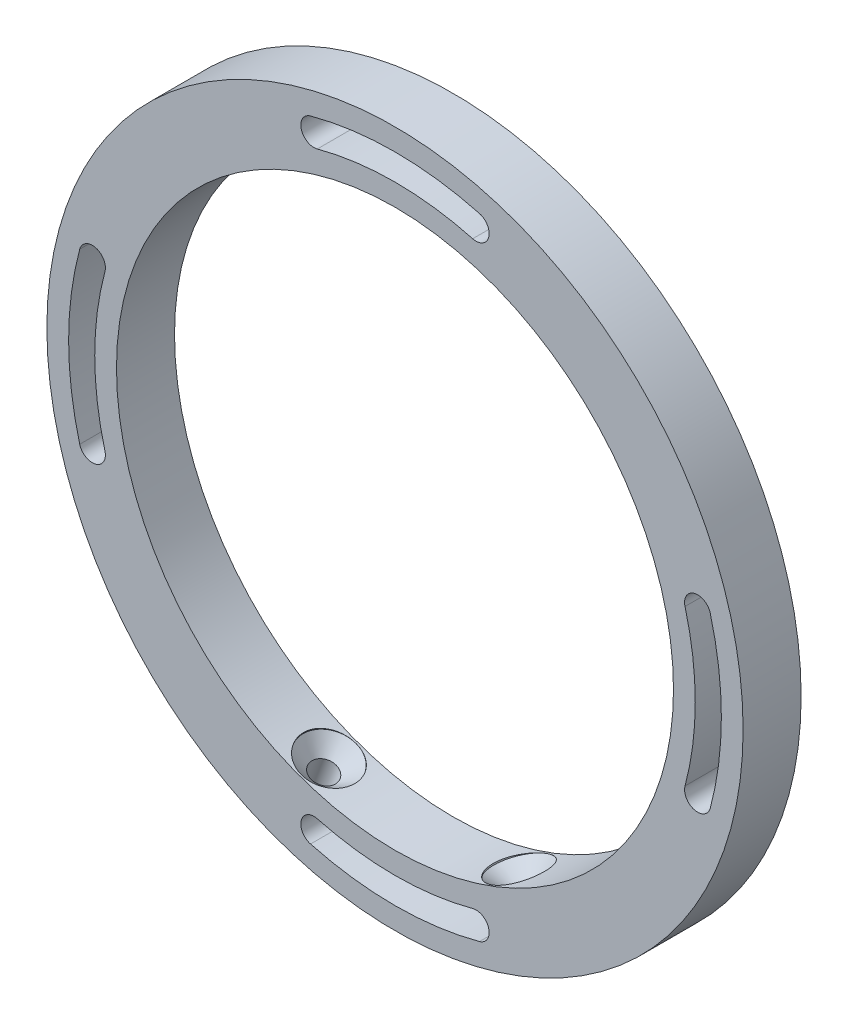
from build123d import *

# Parameters (mm, degrees)
SCHIZZO2_R                                       = 60
SCHIZZO2_R_2                                     = 48
ESTRUSIONE_ESTRUSIONE1_DEPTH                     = 10
FORO_SVASATO_PER_VITE_M4_1_D                     = 4.3
FORO_SVASATO_PER_VITE_M4_1_DEPTH                 = 28.902765847
FORO_SVASATO_PER_VITE_M4_1_CSINK_D               = 9.4
FORO_SVASATO_PER_VITE_M4_1_CSINK_ANGLE           = 90
FORO_SVASATO_PER_VITE_M4_1_ON_FACE_2_D           = 4.3
FORO_SVASATO_PER_VITE_M4_1_ON_FACE_2_DEPTH       = 28.902765847
FORO_SVASATO_PER_VITE_M4_1_ON_FACE_2_CSINK_D     = 9.4
FORO_SVASATO_PER_VITE_M4_1_ON_FACE_2_CSINK_ANGLE = 90


with BuildPart() as part:
    # Schizzo2 → Estrusione-Estrusione1 (new body)
    with BuildSketch(Plane.XY):
        Circle(SCHIZZO2_R)
        Circle(SCHIZZO2_R_2, mode=Mode.SUBTRACT)
        with BuildLine():
            ThreePointArc((-54.333327729, 14.558571287), (-56.25, 0), (-54.333327729, -14.558571287))
            ThreePointArc((-54.333327729, -14.558571287), (-51.577651768, -16.149561545), (-49.98666151, -13.393885584))
            ThreePointArc((-49.98666151, -13.393885584), (-51.75, 0), (-49.98666151, 13.393885584))
            ThreePointArc((-49.98666151, 13.393885584), (-51.577651768, 16.149561545), (-54.333327729, 14.558571287))
        make_face(mode=Mode.SUBTRACT)
        with BuildLine():
            ThreePointArc((-13.393885584, -49.98666151), (-16.149561545, -51.577651768), (-14.558571287, -54.333327729))
            ThreePointArc((-14.558571287, -54.333327729), (0, -56.25), (14.558571287, -54.333327729))
            ThreePointArc((14.558571287, -54.333327729), (16.149561545, -51.577651768), (13.393885584, -49.98666151))
            ThreePointArc((13.393885584, -49.98666151), (0, -51.75), (-13.393885584, -49.98666151))
        make_face(mode=Mode.SUBTRACT)
        with BuildLine():
            ThreePointArc((13.393885584, 49.98666151), (16.149561545, 51.577651768), (14.558571287, 54.333327729))
            ThreePointArc((14.558571287, 54.333327729), (0, 56.25), (-14.558571287, 54.333327729))
            ThreePointArc((-14.558571287, 54.333327729), (-16.149561545, 51.577651768), (-13.393885584, 49.98666151))
            ThreePointArc((-13.393885584, 49.98666151), (0, 51.75), (13.393885584, 49.98666151))
        make_face(mode=Mode.SUBTRACT)
        with BuildLine():
            ThreePointArc((54.333327729, 14.558571287), (51.577651768, 16.149561545), (49.98666151, 13.393885584))
            ThreePointArc((49.98666151, 13.393885584), (51.75, 0), (49.98666151, -13.393885584))
            ThreePointArc((49.98666151, -13.393885584), (51.577651768, -16.149561545), (54.333327729, -14.558571287))
            ThreePointArc((54.333327729, -14.558571287), (56.25, 0), (54.333327729, 14.558571287))
        make_face(mode=Mode.SUBTRACT)
    extrude(amount=ESTRUSIONE_ESTRUSIONE1_DEPTH)

    # Foro svasato per Vite M4-1
    with Locations(Plane(origin=(-16.41696688, -45.105245798, 5), x_dir=(0.939692620786, -0.342020143326, 0), z_dir=(0.342020143326, 0.939692620786, 0))):
        with Locations((0, 0)):
            CounterSinkHole(FORO_SVASATO_PER_VITE_M4_1_D / 2, FORO_SVASATO_PER_VITE_M4_1_CSINK_D / 2, depth=FORO_SVASATO_PER_VITE_M4_1_DEPTH, counter_sink_angle=FORO_SVASATO_PER_VITE_M4_1_CSINK_ANGLE)

    # Foro svasato per Vite M4-1 on face 2
    with Locations(Plane(origin=(16.41696688, -45.105245798, 5), x_dir=(0.939692711209, 0.342019894889, 0), z_dir=(-0.342019894889, 0.939692711209, 0))):
        with Locations((0, 0)):
            CounterSinkHole(FORO_SVASATO_PER_VITE_M4_1_ON_FACE_2_D / 2, FORO_SVASATO_PER_VITE_M4_1_ON_FACE_2_CSINK_D / 2, depth=FORO_SVASATO_PER_VITE_M4_1_ON_FACE_2_DEPTH, counter_sink_angle=FORO_SVASATO_PER_VITE_M4_1_ON_FACE_2_CSINK_ANGLE)


solid = part.part
